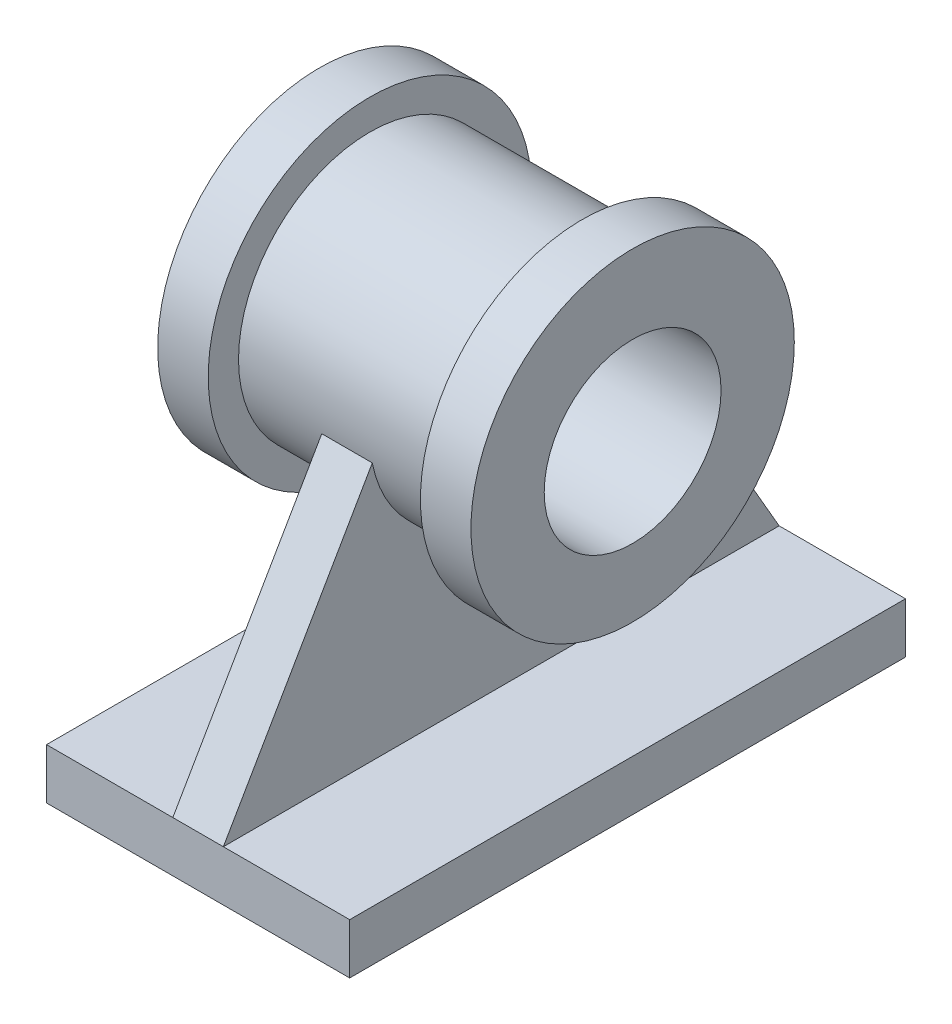
from build123d import *

# Parameters (mm, degrees)
SKETCH_1_W          = 60
SKETCH_1_H          = 110
EXTRUDE_1_DEPTH     = 10
SKETCH_2_W          = 10
SKETCH_2_H          = 110
EXTRUDE_2_DEPTH     = 85
CUT_EXTRUDE_1_DEPTH = 85
SKETCH_4_R          = 26
EXTRUDE_3_DEPTH     = 21
CUT_EXTRUDE_2_DEPTH = 42
SKETCH_6_R          = 32
EXTRUDE_4_DEPTH     = 10
SKETCH_7_R          = 17.5
CUT_EXTRUDE_3_DEPTH = 81


with BuildPart() as part:
    # 스케치1 → 보스-돌출1 (new body)
    with BuildSketch(Plane(origin=(0, 0, 0), x_dir=(1, 0, 0), z_dir=(0, 1, 0))):
        Rectangle(SKETCH_1_W, SKETCH_1_H)
    extrude(amount=EXTRUDE_1_DEPTH)

    # 스케치2 → 보스-돌출2 (add)
    with BuildSketch(Plane(origin=(0, 10, 0), x_dir=(1, 0, 0), z_dir=(0, 1, 0))):
        Rectangle(SKETCH_2_W, SKETCH_2_H)
    extrude(amount=EXTRUDE_2_DEPTH)

    # 스케치3 → 컷-돌출1 (cut)
    with BuildSketch(Plane(origin=(5, 0, 0), x_dir=(0, 0, -1), z_dir=(1, 0, 0))):
        Polygon((-55, 10), (-1.927245104, 101.924707978), (-74.670847317, 101.924707978), (-74.670847317, 10), align=None)
    cut_extrude_1 = extrude(amount=-CUT_EXTRUDE_1_DEPTH, mode=Mode.SUBTRACT)

    # 대칭 복사1: 컷-돌출1 across plane
    add(cut_extrude_1.mirror(Plane.XY), mode=Mode.SUBTRACT)

    # 스케치4 → 보스-돌출3 (add, symmetric)
    with BuildSketch(Plane(origin=(0, 0, 0), x_dir=(0, 0, -1), z_dir=(1, 0, 0))):
        with Locations((0, 66)):
            Circle(SKETCH_4_R)
    extrude(amount=EXTRUDE_3_DEPTH, both=True)

    # 스케치5 → 컷-돌출2 (cut)
    with BuildSketch(Plane(origin=(21, 0, 0), x_dir=(0, 0, -1), z_dir=(1, 0, 0))):
        with BuildLine():
            Line((-16.854508663, 85.797109328), (-12.442891348, 105.747158049))
            Line((-12.442891348, 105.747158049), (16.049526521, 102.320854634))
            Line((16.049526521, 102.320854634), (20.027337967, 82.58028148))
            ThreePointArc((20.027337967, 82.58028148), (2.259138508, 91.901665838), (-16.854508663, 85.797109328))
        make_face()
    extrude(amount=-CUT_EXTRUDE_2_DEPTH, mode=Mode.SUBTRACT)

    # 스케치6 → 보스-돌출4 (add)
    with BuildSketch(Plane(origin=(21, 0, 0), x_dir=(0, 0, -1), z_dir=(1, 0, 0))):
        with Locations((0, 66)):
            Circle(SKETCH_6_R)
    extrude_4 = extrude(amount=EXTRUDE_4_DEPTH)

    # 대칭 복사2: 보스-돌출4 across plane
    add(extrude_4.mirror(Plane(origin=(0, 0, 0), x_dir=(0, 0, 1), z_dir=(1, 0, 0))))

    # 스케치7 → 컷-돌출3 (cut)
    with BuildSketch(Plane(origin=(31, 0, 0), x_dir=(0, 0, -1), z_dir=(1, 0, 0))):
        with Locations((0, 64.96726993)):
            Circle(SKETCH_7_R)
    extrude(amount=-CUT_EXTRUDE_3_DEPTH, mode=Mode.SUBTRACT)


solid = part.part
